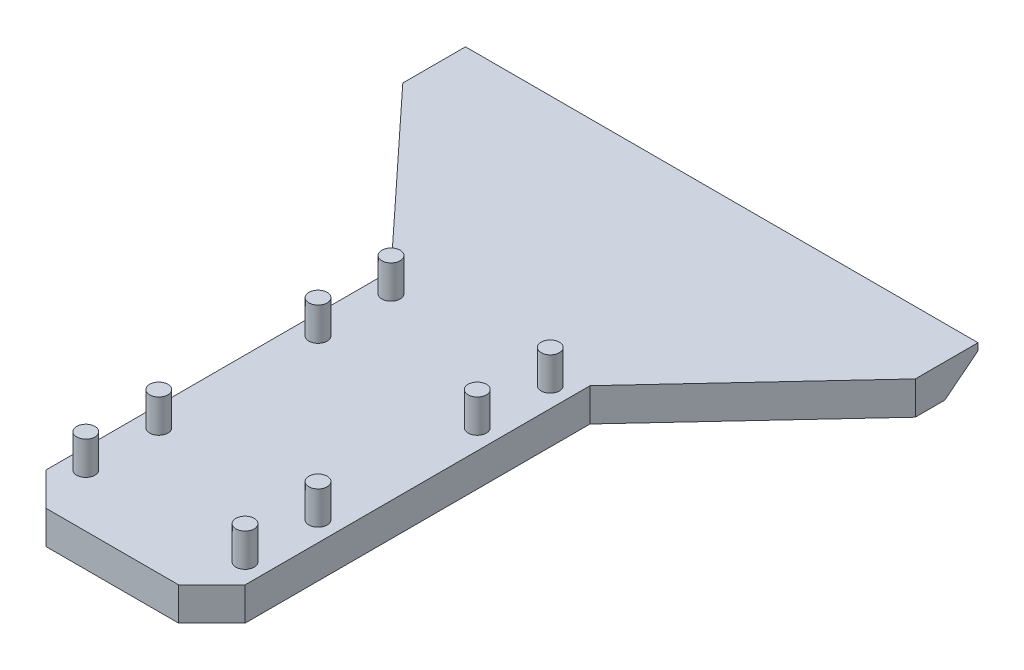
from build123d import *

# Parameters (mm, degrees)
SKETCH3_R           = 1.905
BOSS_EXTRUDE1_DEPTH = 6.35
CUT_EXTRUDE1_DEPTH  = 133.5410974
SKETCH5_R           = 1.905
BOSS_EXTRUDE2_DEPTH = 12.700000124
CUT_EXTRUDE2_START  = -6.350000124
SKETCH6_R           = 1.905
SKETCH6_R_2         = 1.75
CUT_EXTRUDE2_DEPTH  = 6.350000124


with BuildPart() as part:
    # Sketch3 → Boss-Extrude1 (new body)
    with BuildSketch(Plane(origin=(0, 0, 0), x_dir=(1, 0, 0), z_dir=(0, 1, 0))):
        Polygon((-19.05, -82.55), (-12.7, -88.9), (12.7, -88.9), (19.05, -82.55), (19.05, -74.93), (19.05, -68.58), (19.05, -60.96), (19.05, -38.1), (19.05, -30.48), (19.05, -24.13), (19.05, -16.51), (49.05, 15.745), (49.05, 27.745), (-49.05, 27.745), (-49.05, 15.745), (-19.05, -16.51), (-19.05, -24.13), (-19.05, -30.48), (-19.05, -38.1), (-19.05, -60.96), (-19.05, -68.58), (-19.05, -74.93), align=None)
        with Locations(Location((-15.24, -78.74, 0), (0, 0, 270))):
            Circle(SKETCH3_R, mode=Mode.SUBTRACT)
        with Locations(Location((15.24, -78.74, 0), (0, 0, 270))):
            Circle(SKETCH3_R, mode=Mode.SUBTRACT)
        with Locations(Location((15.24, -64.77, 0), (0, 0, 270))):
            Circle(SKETCH3_R, mode=Mode.SUBTRACT)
        with Locations(Location((-15.24, -64.77, 0), (0, 0, 270))):
            Circle(SKETCH3_R, mode=Mode.SUBTRACT)
        with Locations(Location((-15.24, -20.32, 0), (0, 0, 270))):
            Circle(SKETCH3_R, mode=Mode.SUBTRACT)
        with Locations(Location((15.24, -20.32, 0), (0, 0, 270))):
            Circle(SKETCH3_R, mode=Mode.SUBTRACT)
        with Locations(Location((15.24, -34.29, 0), (0, 0, 270))):
            Circle(SKETCH3_R, mode=Mode.SUBTRACT)
        with Locations(Location((-15.24, -34.29, 0), (0, 0, 270))):
            Circle(SKETCH3_R, mode=Mode.SUBTRACT)
    extrude(amount=BOSS_EXTRUDE1_DEPTH)

    # Sketch4 → Cut-Extrude1 (cut, through all)
    with BuildSketch(Plane.ZY.offset(49.05)):
        Polygon((-21.395, 0), (-27.745, 0), (-27.745, 5), align=None)
    extrude(amount=-CUT_EXTRUDE1_DEPTH, mode=Mode.SUBTRACT)

    # Sketch5 → Boss-Extrude2 (add)
    with BuildSketch(Plane.XZ):
        with Locations(Location((-15.24, 20.32, 0), (0, 0, 270))):
            Circle(SKETCH5_R)
        with Locations(Location((-15.24, 34.29, 0), (0, 0, 270))):
            Circle(SKETCH5_R)
        with Locations(Location((15.24, 20.32, 0), (0, 0, 270))):
            Circle(SKETCH5_R)
        with Locations(Location((15.24, 34.29, 0), (0, 0, 270))):
            Circle(SKETCH5_R)
        with Locations(Location((15.24, 64.77, 0), (0, 0, 270))):
            Circle(SKETCH5_R)
        with Locations(Location((15.24, 78.74, 0), (0, 0, 270))):
            Circle(SKETCH5_R)
        with Locations(Location((-15.24, 64.77, 0), (0, 0, 270))):
            Circle(SKETCH5_R)
        with Locations(Location((-15.24, 78.74, 0), (0, 0, 270))):
            Circle(SKETCH5_R)
    extrude(amount=-BOSS_EXTRUDE2_DEPTH)

    # Sketch6 → Cut-Extrude2 (cut)
    # profile 1 of 8: a face of its own
    with BuildSketch(Plane(origin=(0, 12.700000124, 0), x_dir=(1, 0, 0), z_dir=(0, 1, 0)).offset(CUT_EXTRUDE2_START)):
        with Locations((-15.24, -78.74)):
            Circle(SKETCH6_R)
        with Locations(Location((-15.24, -78.74, 0), (0, 0, 270))):
            Circle(SKETCH6_R_2, mode=Mode.SUBTRACT)
    # profile 2 of 8: a face of its own
    with BuildSketch(Plane(origin=(0, 12.700000124, 0), x_dir=(1, 0, 0), z_dir=(0, 1, 0)).offset(CUT_EXTRUDE2_START)):
        with Locations((15.24, -78.74)):
            Circle(SKETCH6_R)
        with Locations(Location((15.24, -78.74, 0), (0, 0, 270))):
            Circle(SKETCH6_R_2, mode=Mode.SUBTRACT)
    # profile 3 of 8: a face of its own
    with BuildSketch(Plane(origin=(0, 12.700000124, 0), x_dir=(1, 0, 0), z_dir=(0, 1, 0)).offset(CUT_EXTRUDE2_START)):
        with Locations((15.24, -64.77)):
            Circle(SKETCH6_R)
        with Locations(Location((15.24, -64.77, 0), (0, 0, 270))):
            Circle(SKETCH6_R_2, mode=Mode.SUBTRACT)
    # profile 4 of 8: a face of its own
    with BuildSketch(Plane(origin=(0, 12.700000124, 0), x_dir=(1, 0, 0), z_dir=(0, 1, 0)).offset(CUT_EXTRUDE2_START)):
        with Locations((-15.24, -64.77)):
            Circle(SKETCH6_R)
        with Locations(Location((-15.24, -64.77, 0), (0, 0, 270))):
            Circle(SKETCH6_R_2, mode=Mode.SUBTRACT)
    # profile 5 of 8: a face of its own
    with BuildSketch(Plane(origin=(0, 12.700000124, 0), x_dir=(1, 0, 0), z_dir=(0, 1, 0)).offset(CUT_EXTRUDE2_START)):
        with Locations((-15.24, -34.29)):
            Circle(SKETCH6_R)
        with Locations(Location((-15.24, -34.29, 0), (0, 0, 270))):
            Circle(SKETCH6_R_2, mode=Mode.SUBTRACT)
    # profile 6 of 8: a face of its own
    with BuildSketch(Plane(origin=(0, 12.700000124, 0), x_dir=(1, 0, 0), z_dir=(0, 1, 0)).offset(CUT_EXTRUDE2_START)):
        with Locations((15.24, -34.29)):
            Circle(SKETCH6_R)
        with Locations(Location((15.24, -34.29, 0), (0, 0, 270))):
            Circle(SKETCH6_R_2, mode=Mode.SUBTRACT)
    # profile 7 of 8: a face of its own
    with BuildSketch(Plane(origin=(0, 12.700000124, 0), x_dir=(1, 0, 0), z_dir=(0, 1, 0)).offset(CUT_EXTRUDE2_START)):
        with Locations((15.24, -20.32)):
            Circle(SKETCH6_R)
        with Locations(Location((15.24, -20.32, 0), (0, 0, 270))):
            Circle(SKETCH6_R_2, mode=Mode.SUBTRACT)
    # profile 8 of 8: a face of its own
    with BuildSketch(Plane(origin=(0, 12.700000124, 0), x_dir=(1, 0, 0), z_dir=(0, 1, 0)).offset(CUT_EXTRUDE2_START)):
        with Locations((-15.24, -20.32)):
            Circle(SKETCH6_R)
        with Locations(Location((-15.24, -20.32, 0), (0, 0, 270))):
            Circle(SKETCH6_R_2, mode=Mode.SUBTRACT)
    extrude(amount=CUT_EXTRUDE2_DEPTH, mode=Mode.SUBTRACT)


solid = part.part
